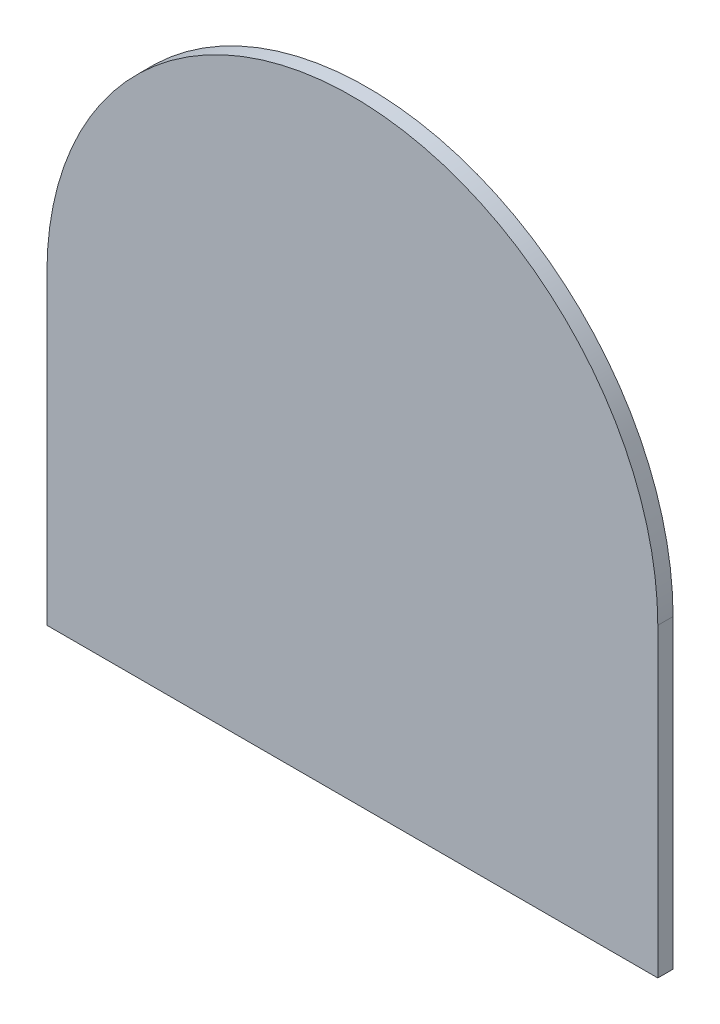
from build123d import *

# Parameters (mm, degrees)
EXTRUDE1_DEPTH = 3.175


with BuildPart() as part:
    # Sketch1 → Extrude1 (new body)
    with BuildSketch(Plane.XY):
        with BuildLine():
            Line((0, 0), (127, 0))
            Line((127, 0), (127, 63.5))
            ThreePointArc((127, 63.5), (63.5, 127), (0, 63.5))
            Line((0, 63.5), (0, 0))
        make_face()
    extrude(amount=-EXTRUDE1_DEPTH)


solid = part.part
